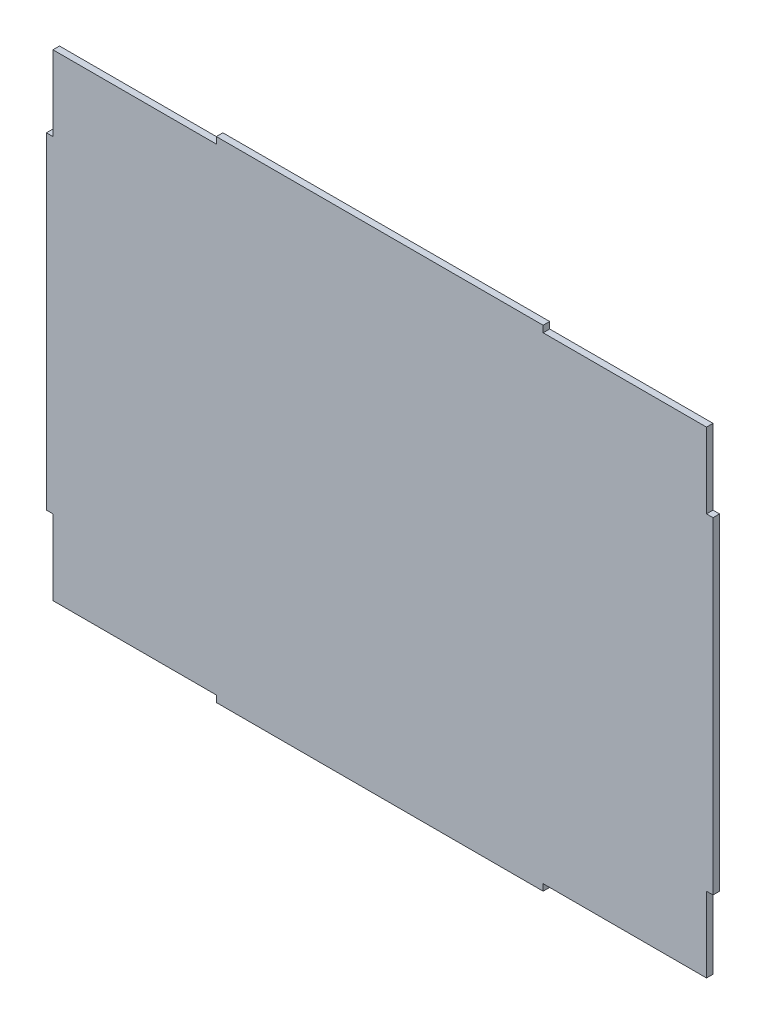
from build123d import *

# Parameters (mm, degrees)
BOSS_EXTRUDE1_DEPTH = 2


with BuildPart() as part:
    # Sketch1 → Boss-Extrude1 (new body)
    with BuildSketch(Plane.XY):
        Polygon((0, 0), (0, -23), (-2, -23), (-2, -123), (0, -123), (0, -146), (50, -146), (50, -148), (100, -148), (100, 2), (50, 2), (50, 0), align=None)
    boss_extrude1 = extrude(amount=BOSS_EXTRUDE1_DEPTH)

    # Mirror2: Boss-Extrude1 across plane
    add(boss_extrude1.mirror(Plane(origin=(100, -148, 2), x_dir=(0, 0, 1), z_dir=(-1, 0, 0))))


solid = part.part
